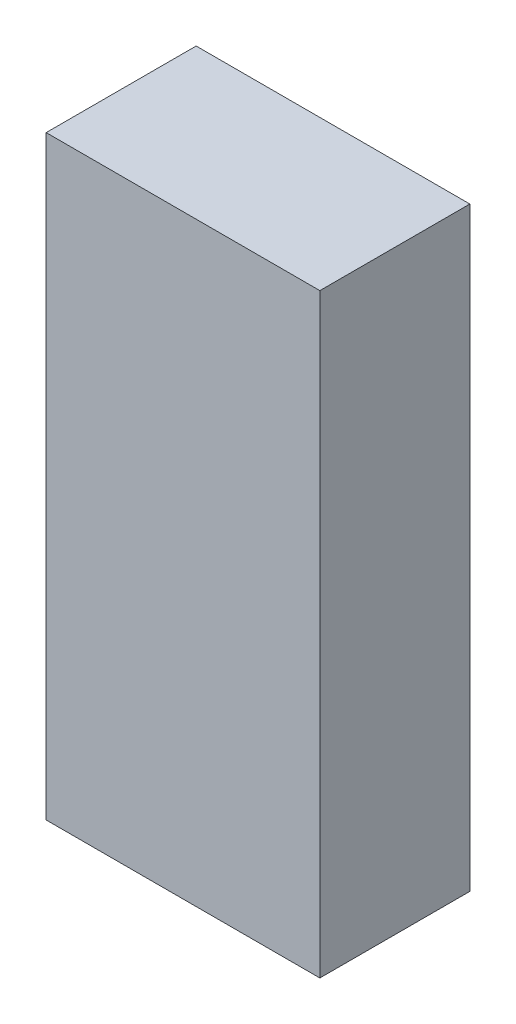
from build123d import *

# Parameters (mm, degrees)
SKETCH1_W           = 17.7
SKETCH1_H           = 9.7
BOSS_EXTRUDE1_DEPTH = 38.5


with BuildPart() as part:
    # Sketch1 → Boss-Extrude1 (new body)
    with BuildSketch(Plane(origin=(0, 0, 0), x_dir=(1, 0, 0), z_dir=(0, 1, 0))):
        Rectangle(SKETCH1_W, SKETCH1_H)
    extrude(amount=BOSS_EXTRUDE1_DEPTH)


solid = part.part
